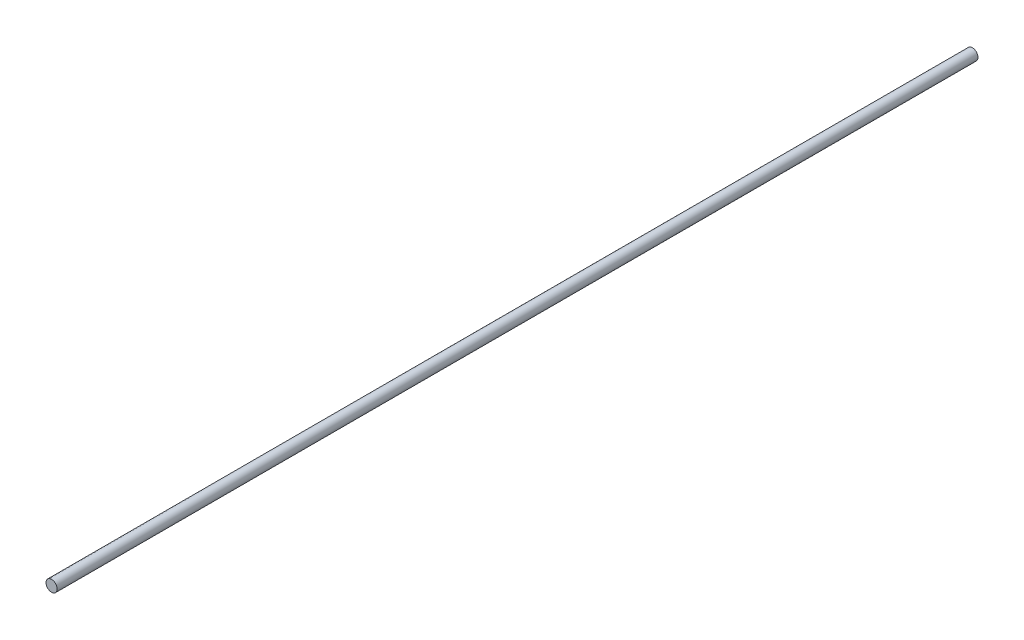
from build123d import *

# Parameters (mm, degrees)
SKETCH1_R           = 4.7625
BOSS_EXTRUDE1_DEPTH = 784.225


with BuildPart() as part:
    # Sketch1 → Boss-Extrude1 (new body)
    with BuildSketch(Plane.XY):
        Circle(SKETCH1_R)
    extrude(amount=-BOSS_EXTRUDE1_DEPTH)


solid = part.part
